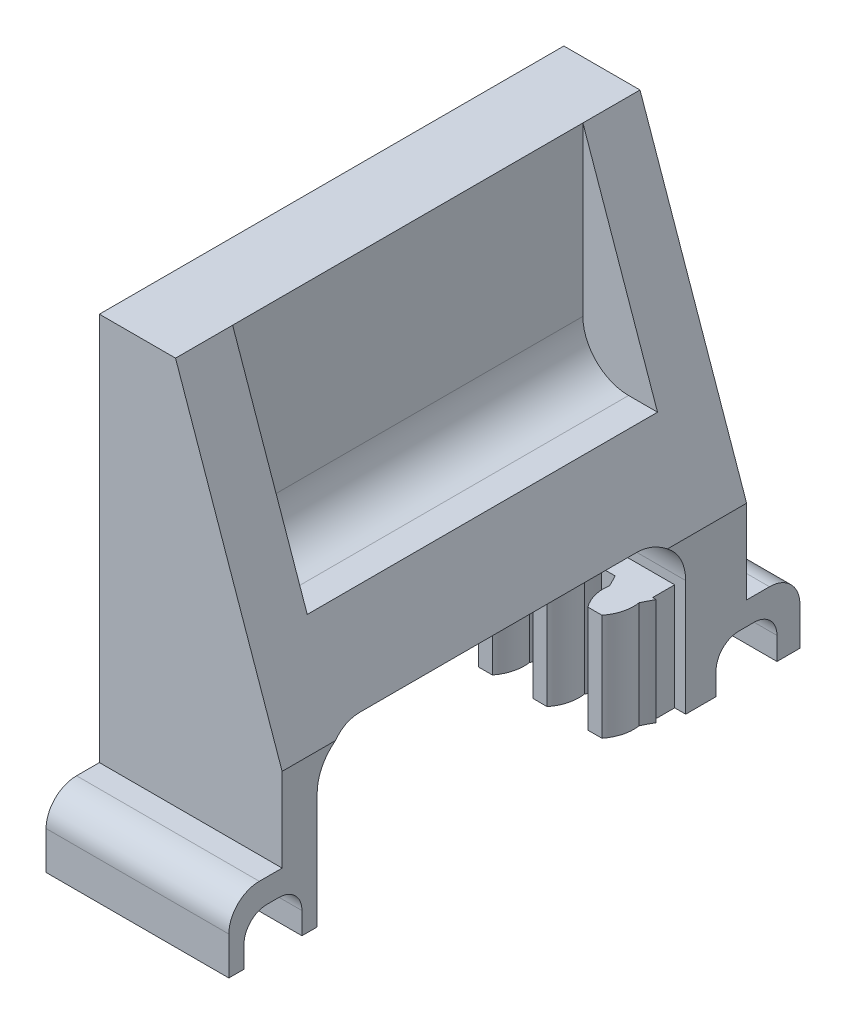
from build123d import *

# Parameters (mm, degrees)
BOSS_EXTRUDE1_DEPTH = 30.5
SKETCH4_W           = 24.2
SKETCH4_H           = 13
CUT_EXTRUDE2_DEPTH  = 25
CUT_EXTRUDE4_DEPTH  = 11.5
SKETCH7_W           = 31
SKETCH7_H           = 1.7
BOSS_EXTRUDE3_DEPTH = 7
BOSS_EXTRUDE4_DEPTH = 7
LPATTERN1_COUNT     = 8
LPATTERN1_PITCH     = 3.6
SKETCH11_W          = 12
SKETCH11_H          = 4.5
BOSS_EXTRUDE5_DEPTH = 3.5
FILLET1_R           = 2
FILLET2_R           = 2
FILLET5_R           = 3
SKETCH12_W          = 4
SKETCH12_H          = 3.5
SKETCH12_W_2        = 3.8
CUT_EXTRUDE5_DEPTH  = 12
FILLET6_R           = 1.5


with BuildPart() as part:
    # Sketch1 → Boss-Extrude1 (new body)
    with BuildSketch(Plane.XY):
        Polygon((0, 0), (0, -30), (12, -30), (12, -20), (5, 0), align=None)
    extrude(amount=-BOSS_EXTRUDE1_DEPTH)

    # Sketch4 → Cut-Extrude2 (cut)
    with BuildSketch(Plane.ZY):
        with Locations((-14.4, -25.899949695)):
            Rectangle(SKETCH4_W, SKETCH4_H)
    extrude(amount=-CUT_EXTRUDE2_DEPTH, mode=Mode.SUBTRACT)

    # Sketch6 → Cut-Extrude4 (cut, symmetric)
    with BuildSketch(Plane.XY.offset(-15.25)):
        Polygon((5, 0), (5, -14), (9.9, -14), align=None)
    extrude(amount=CUT_EXTRUDE4_DEPTH, both=True, mode=Mode.SUBTRACT)

    # Sketch7 → Boss-Extrude3 (add)
    with BuildSketch(Plane(origin=(0, -30, 0), x_dir=(1, 0, 0), z_dir=(0, 1, 0))):
        with Locations((-4.2231607, 25.9)):
            Rectangle(SKETCH7_W, SKETCH7_H)
    extrude(amount=BOSS_EXTRUDE3_DEPTH)

    # Sketch10 → Boss-Extrude4 (add)
    with BuildSketch(Plane(origin=(0, -30, 0), x_dir=(1, 0, 0), z_dir=(0, 1, 0))):
        with BuildLine():
            Line((10.621636646, 22.381188189), (9.701086249, 22.381188189))
            ThreePointArc((9.701086249, 22.381188189), (9.246170102, 23.293637842), (9.190157183, 24.311663197))
            ThreePointArc((9.190157183, 24.311663197), (9.009091816, 24.685106498), (8.811361447, 25.05))
            Line((8.811361447, 25.05), (11.511361447, 25.05))
            ThreePointArc((11.511361447, 25.05), (11.313631078, 24.685106498), (11.132565711, 24.311663197))
            ThreePointArc((11.132565711, 24.311663197), (11.076552792, 23.293637842), (10.621636646, 22.381188189))
        make_face()
    boss_extrude4 = extrude(amount=BOSS_EXTRUDE4_DEPTH)

    # LPattern1: Boss-Extrude4 ×8
    with Locations(*[(-i * LPATTERN1_PITCH, 0, 0) for i in range(1, LPATTERN1_COUNT)]):
        add(boss_extrude4)

    # Sketch11 → Boss-Extrude5 (add)
    with BuildSketch(Plane(origin=(0, 0, -30.5), x_dir=(-1, 0, 0), z_dir=(0, 0, -1))):
        with Locations((-6, -27.75)):
            Rectangle(SKETCH11_W, SKETCH11_H)
    boss_extrude5 = extrude(amount=BOSS_EXTRUDE5_DEPTH)

    # Fillet1
    fillet1_edges = [part.edges().sort_by_distance(p)[0] for p in [
        (6, -25.5, -34),
    ]]
    fillet(fillet1_edges, radius=FILLET1_R)

    # Mirror1: Boss-Extrude5 across plane
    add(boss_extrude5.mirror(Plane.XY.offset(-15.25)))

    # Fillet2
    fillet2_edges = [part.edges().sort_by_distance(p)[0] for p in [
        (6, -25.5, 3.5),
    ]]
    fillet(fillet2_edges, radius=FILLET2_R)

    # Fillet5
    fillet5_edges = [part.edges().sort_by_distance(p)[0] for p in [
        (5, -14, -15.25),
        (5.894991197, -19.399949695, -2.3),
        (5.894991197, -19.399949695, -26.5),
    ]]
    fillet(fillet5_edges, radius=FILLET5_R)

    # Sketch12 → Cut-Extrude5 (cut)
    with BuildSketch(Plane.ZY):
        with Locations((-30.494628275, -28.768411502)):
            Rectangle(SKETCH12_W, SKETCH12_H)
        with Locations((0.6, -28.814354386)):
            Rectangle(SKETCH12_W_2, SKETCH12_H)
    extrude(amount=-CUT_EXTRUDE5_DEPTH, mode=Mode.SUBTRACT)

    # Fillet6
    fillet6_edges = [part.edges().sort_by_distance(p)[0] for p in [
        (6, -27.018411502, -28.494628275),
        (6, -27.018411502, -32.494628275),
        (6, -27.064354386, -1.3),
        (6, -27.064354386, 2.5),
    ]]
    fillet(fillet6_edges, radius=FILLET6_R)


solid = part.part
